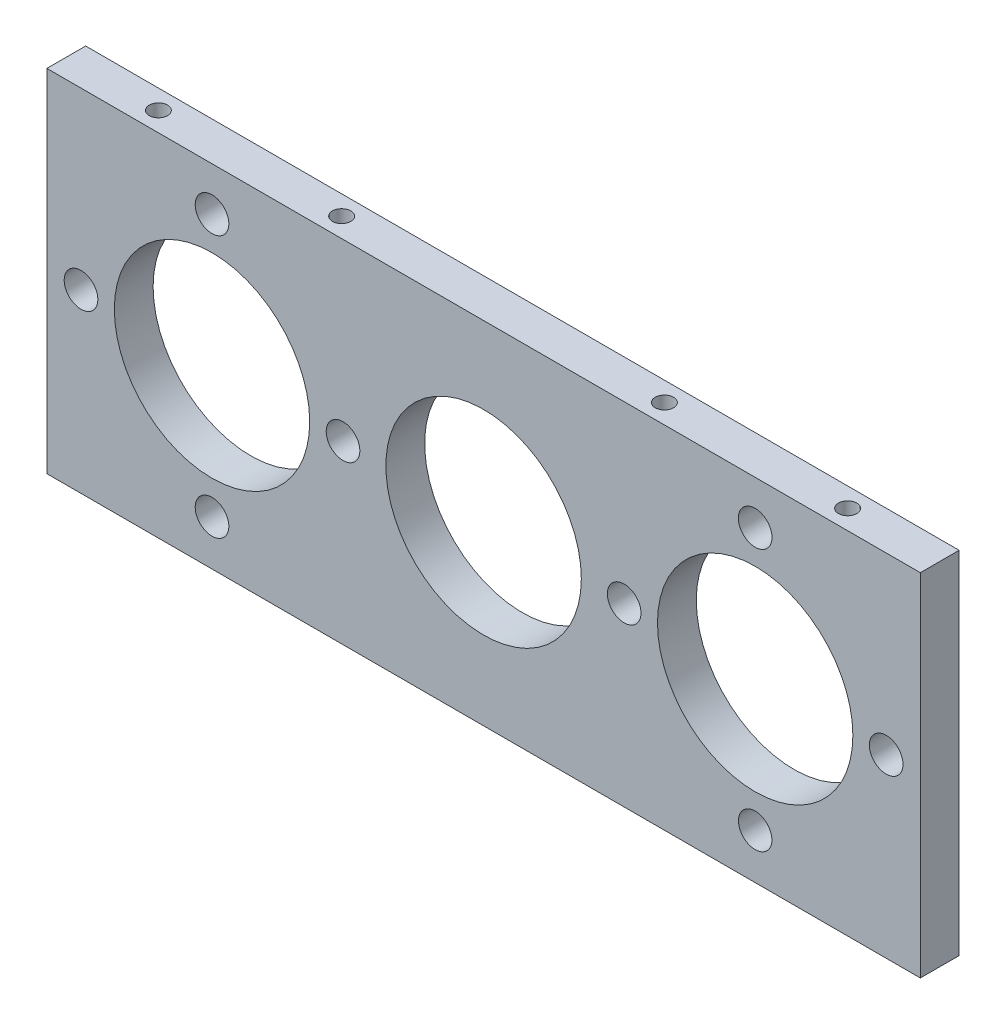
from build123d import *

# Parameters (mm, degrees)
ESBO_O1_W                = 143.01
ESBO_O1_H                = 54.05
RESSALTO_EXTRUS_O1_DEPTH = 6.35
ESBO_O2_R                = 2.755
ESBO_O2_R_2              = 2.755565393
ESBO_O2_R_3              = 2.735691737
CORTE_EXTRUS_O1_DEPTH    = 6.35
ESBO_O3_R                = 15.995
ESBO_O3_R_2              = 10
CORTE_EXTRUS_O2_DEPTH    = 10
ESBO_O4_W                = 143.01
ESBO_O4_H                = 3.42
RESSALTO_EXTRUS_O2_DEPTH = 6.35
ESBO_O5_R                = 16
CORTE_EXTRUS_O3_DEPTH    = 10
ESBO_O6_R                = 1.5
CORTE_EXTRUS_O4_DEPTH    = 15


with BuildPart() as part:
    # Esboço1 → Ressalto-extrusão1 (new body)
    with BuildSketch(Plane.XY):
        Rectangle(ESBO_O1_W, ESBO_O1_H)
    extrude(amount=RESSALTO_EXTRUS_O1_DEPTH)

    # Esboço2 → Corte-extrusão1 (cut)
    with BuildSketch(Plane(origin=(0, 0, 0), x_dir=(-1, 0, 0), z_dir=(0, 0, -1))):
        with Locations((-44.463136928, 23.291850449)):
            Circle(ESBO_O2_R)
        with Locations((-65.913136928, 1.841850449)):
            Circle(ESBO_O2_R_2)
        with Locations((-44.463136928, -19.608149551)):
            Circle(ESBO_O2_R_3)
        with Locations((-23.013136928, 1.841850449)):
            Circle(ESBO_O2_R)
        with Locations((23.016863072, 1.841850449)):
            Circle(ESBO_O2_R)
        with Locations((44.466863072, -19.608149551)):
            Circle(ESBO_O2_R)
        with Locations((65.916863072, 1.841850449)):
            Circle(ESBO_O2_R)
        with Locations((44.466863072, 23.291850449)):
            Circle(ESBO_O2_R)
    extrude(amount=-CORTE_EXTRUS_O1_DEPTH, mode=Mode.SUBTRACT)

    # Esboço3 → Corte-extrusão2 (cut)
    with BuildSketch(Plane(origin=(0, 0, 0), x_dir=(-1, 0, 0), z_dir=(0, 0, -1))):
        with Locations((-44.463136928, 1.841850449)):
            Circle(ESBO_O3_R)
        with Locations((0.001863072, 1.841850449)):
            Circle(ESBO_O3_R_2)
        with Locations((44.466863072, 1.841850449)):
            Circle(ESBO_O3_R)
    extrude(amount=-CORTE_EXTRUS_O2_DEPTH, mode=Mode.SUBTRACT)

    # Esboço4 → Ressalto-extrusão2 (add)
    with BuildSketch(Plane.XY):
        with Locations((0, 28.735)):
            Rectangle(ESBO_O4_W, ESBO_O4_H)
    extrude(amount=RESSALTO_EXTRUS_O2_DEPTH)

    # Esboço5 → Corte-extrusão3 (cut)
    with BuildSketch(Plane.XY.offset(6.35)):
        with Locations((-0.001863072, 1.841850449)):
            Circle(ESBO_O5_R)
    extrude(amount=-CORTE_EXTRUS_O3_DEPTH, mode=Mode.SUBTRACT)

    # Esboço6 → Corte-extrusão4 (cut)
    with BuildSketch(Plane(origin=(0, 30.445, 0), x_dir=(1, 0, 0), z_dir=(0, 1, 0))):
        with Locations(Location((56.423186497, -3.175, 0), (0, 0, 270))):
            Circle(ESBO_O6_R)
        with Locations(Location((26.423186497, -3.175, 0), (0, 0, 270))):
            Circle(ESBO_O6_R)
        with Locations(Location((-26.423186497, -3.175, 0), (0, 0, 90))):
            Circle(ESBO_O6_R)
        with Locations(Location((-56.423186497, -3.175, 0), (0, 0, 90))):
            Circle(ESBO_O6_R)
    extrude(amount=-CORTE_EXTRUS_O4_DEPTH, mode=Mode.SUBTRACT)


solid = part.part
